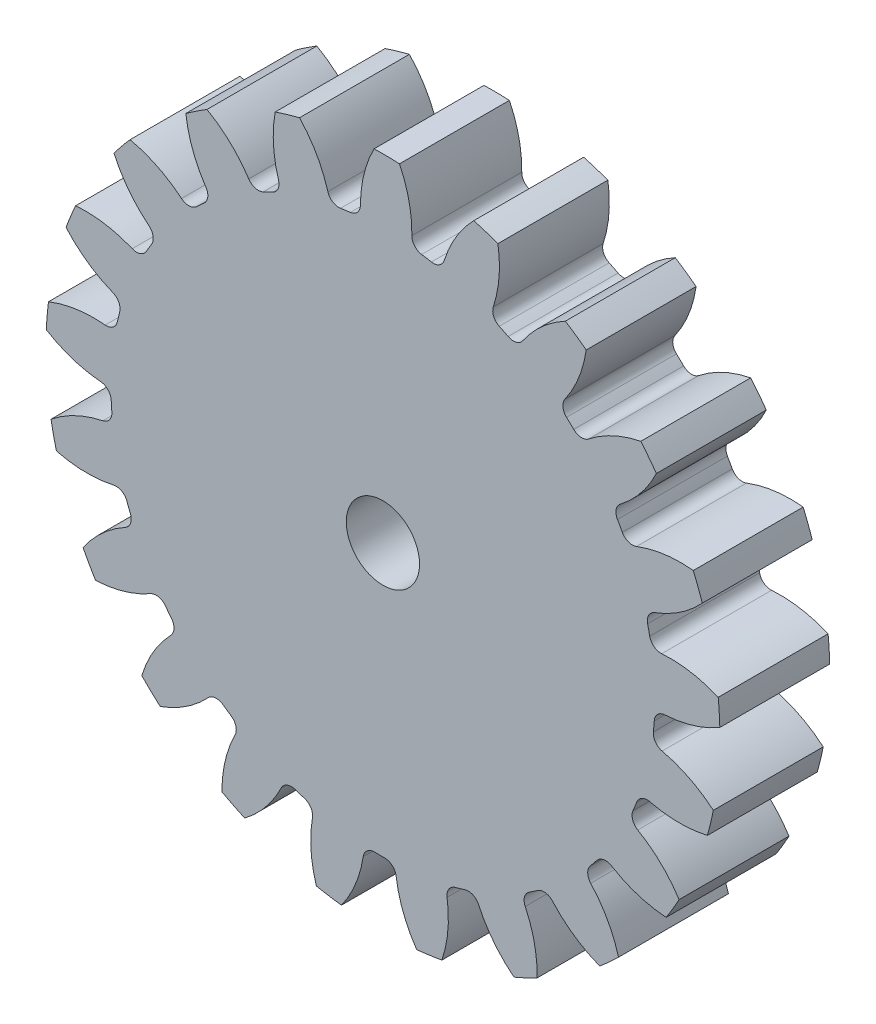
from build123d import *

# Parameters (mm, degrees)
SKETCH3_R         = 29.21
GEARBODY_DEPTH    = 9.525
TOOTHCUT_DEPTH    = 43.393086995
CIRPATTERN1_COUNT = 21
BOREDIA_R         = 3.175
BORE_DEPTH        = 12700


with BuildPart() as part:
    # Sketch3 → gearBody (new body)
    with BuildSketch(Plane.XY):
        with Locations(Location((0, 0, 0), (0, 0, 180))):
            Circle(SKETCH3_R)
    extrude(amount=GEARBODY_DEPTH)

    # Sketch2 → toothCut (cut, through all)
    with BuildSketch(Plane.XY):
        with BuildLine():
            ThreePointArc((23.442545004, -2.459380651), (23.483538981, -2.030976705), (23.516704691, -1.60189573))
            ThreePointArc((23.516704691, -1.60189573), (23.807353748, -0.967754339), (24.445003112, -0.684884285))
            ThreePointArc((24.445003112, -0.684884285), (29.057989243, 0.666045086), (32.597529938, 3.918167912))
            ThreePointArc((32.597529938, 3.918167912), (32.710061637, -2.828933631), (31.44081739, -9.456532114))
            ThreePointArc((31.44081739, -9.456532114), (28.512177065, -5.645007872), (24.199621674, -3.522151965))
            ThreePointArc((24.199621674, -3.522151965), (23.620005166, -3.134006525), (23.442545004, -2.459380651))
        make_face()
    toothcut = extrude(amount=TOOTHCUT_DEPTH, mode=Mode.SUBTRACT)

    # CirPattern1: toothCut ×21 about axis
    cirpattern1_axis = Axis((0, 0, 0), (0, 0, 1))
    for i in range(1, CIRPATTERN1_COUNT):
        add(toothcut.rotate(cirpattern1_axis, i * 360 / CIRPATTERN1_COUNT), mode=Mode.SUBTRACT)

    # boreDia → bore (cut, symmetric)
    with BuildSketch(Plane.XY):
        Circle(BOREDIA_R)
    extrude(amount=BORE_DEPTH, both=True, mode=Mode.SUBTRACT)


solid = part.part
